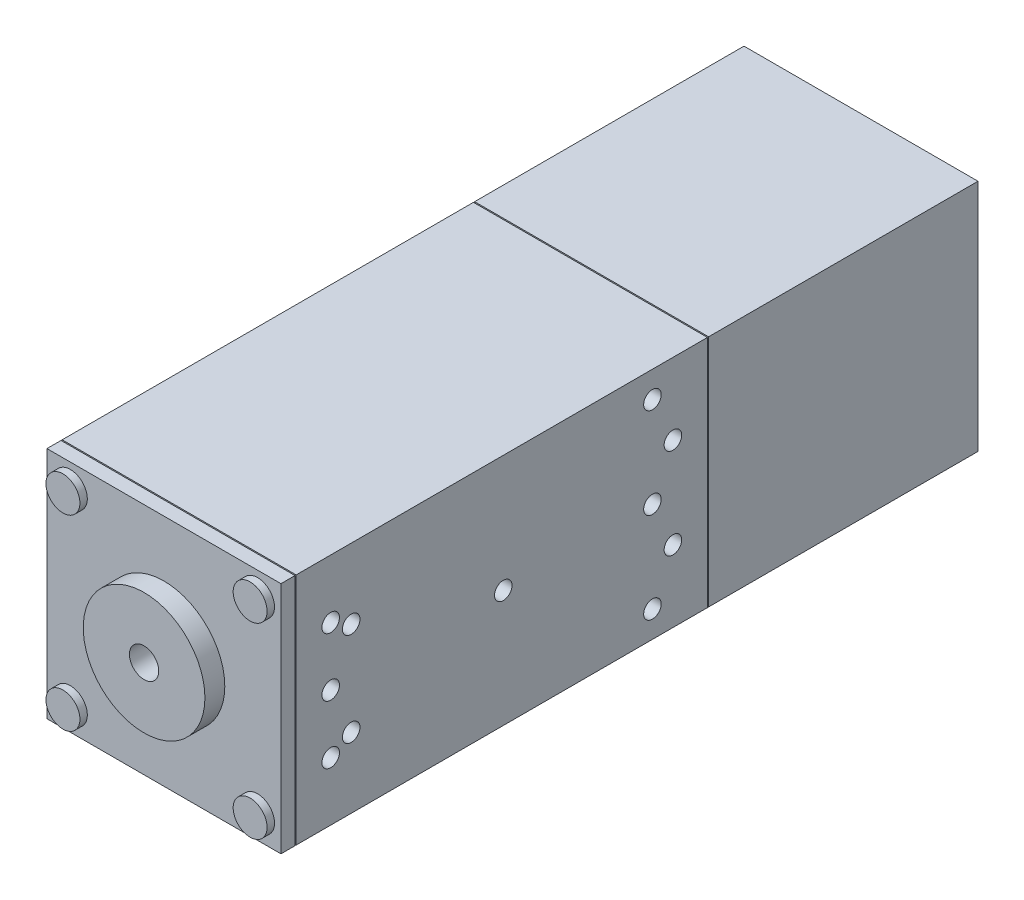
from build123d import *

# Parameters (mm, degrees)
CROQUIS1_W              = 40
CROQUIS1_H              = 40
SALIENTE_EXTRUIR1_DEPTH = 119.15
CROQUIS2_R              = 10.4
SALIENTE_EXTRUIR2_DEPTH = 3.4
SALIENTE_EXTRUIR3_DEPTH = 1.27
CROQUIS4_R              = 2.5
CORTAR_EXTRUIR1_DEPTH   = 5
CROQUIS5_W              = 9
CROQUIS5_H              = 6
CORTAR_EXTRUIR2_DEPTH   = 9
CROQUIS6_R              = 1.5
CORTAR_EXTRUIR3_DEPTH   = 3.5
SALIENTE_EXTRUIR4_DEPTH = 8
CROQUIS10_W             = 0.2
CROQUIS10_H             = 40
CORTAR_EXTRUIR4_DEPTH   = 0.2
MATRIZC1_COUNT          = 4


with BuildPart() as part:
    # Croquis1 → Saliente-Extruir1 (new body)
    with BuildSketch(Plane.XY):
        Rectangle(CROQUIS1_W, CROQUIS1_H)
    extrude(amount=-SALIENTE_EXTRUIR1_DEPTH)

    # Croquis2 → Saliente-Extruir2 (add)
    with BuildSketch(Plane.XY):
        Circle(CROQUIS2_R)
    extrude(amount=SALIENTE_EXTRUIR2_DEPTH)

    # Croquis3 → Saliente-Extruir3 (add)
    with BuildSketch(Plane.XY):
        with BuildLine():
            Line((-16, 13.1), (-16, 16))
            Line((-16, 16), (-13.1, 16))
            ThreePointArc((-13.1, 16), (-18.050609665, 18.050609665), (-16, 13.1))
        make_face()
        with BuildLine():
            Line((-13.1, 16), (-16, 16))
            Line((-16, 16), (-16, 13.1))
            ThreePointArc((-16, 13.1), (-13.949390335, 13.949390335), (-13.1, 16))
        make_face()
        with BuildLine():
            ThreePointArc((18.9, 16), (16, 18.9), (13.1, 16))
            Line((13.1, 16), (16, 16))
            Line((16, 16), (16, 13.1))
            ThreePointArc((16, 13.1), (18.050609665, 13.949390335), (18.9, 16))
        make_face()
        with BuildLine():
            Line((16, 16), (13.1, 16))
            ThreePointArc((13.1, 16), (13.949390335, 13.949390335), (16, 13.1))
            Line((16, 13.1), (16, 16))
        make_face()
        with BuildLine():
            ThreePointArc((-13.1, -16), (-13.949390335, -13.949390335), (-16, -13.1))
            Line((-16, -13.1), (-16, -16))
            Line((-16, -16), (-13.1, -16))
        make_face()
        with BuildLine():
            Line((-16, -16), (-16, -13.1))
            ThreePointArc((-16, -13.1), (-18.050609665, -18.050609665), (-13.1, -16))
            Line((-13.1, -16), (-16, -16))
        make_face()
        with BuildLine():
            ThreePointArc((18.9, -16), (18.050609665, -13.949390335), (16, -13.1))
            Line((16, -13.1), (16, -16))
            Line((16, -16), (13.1, -16))
            ThreePointArc((13.1, -16), (16, -18.9), (18.9, -16))
        make_face()
        with BuildLine():
            Line((16, -16), (16, -13.1))
            ThreePointArc((16, -13.1), (13.949390335, -13.949390335), (13.1, -16))
            Line((13.1, -16), (16, -16))
        make_face()
    extrude(amount=SALIENTE_EXTRUIR3_DEPTH)

    # Croquis4 → Cortar-Extruir1 (cut)
    with BuildSketch(Plane.XY.offset(3.4)):
        Circle(CROQUIS4_R)
    extrude(amount=-CORTAR_EXTRUIR1_DEPTH, mode=Mode.SUBTRACT)

    # Croquis5 → Cortar-Extruir2 (cut)
    with BuildSketch(Plane(origin=(0, 0, -119.15), x_dir=(-1, 0, 0), z_dir=(0, 0, -1))):
        with Locations((0, -17)):
            Rectangle(CROQUIS5_W, CROQUIS5_H)
    extrude(amount=-CORTAR_EXTRUIR2_DEPTH, mode=Mode.SUBTRACT)

    # Croquis6 → Cortar-Extruir3 (cut)
    with BuildSketch(Plane(origin=(20, 0, 0), x_dir=(0, 0, -1), z_dir=(1, 0, 0))):
        with Locations(Location((38, 0, 0), (0, 0, 90))):
            Circle(CROQUIS6_R)
        with Locations(Location((8.5, 0, 0), (0, 0, 90))):
            Circle(CROQUIS6_R)
        with Locations(Location((63.5, 0, 0), (0, 0, 90))):
            Circle(CROQUIS6_R)
        with Locations(Location((12, 8, 0), (0, 0, 90))):
            Circle(CROQUIS6_R)
        with Locations(Location((12, -8, 0), (0, 0, 90))):
            Circle(CROQUIS6_R)
        with Locations(Location((8.5, -10, 0), (0, 0, 90))):
            Circle(CROQUIS6_R)
        with Locations(Location((8.5, 10, 0), (0, 0, 90))):
            Circle(CROQUIS6_R)
        with Locations(Location((67, -7.75, 0), (0, 0, 90))):
            Circle(CROQUIS6_R)
        with Locations(Location((63.5, -15.5, 0), (0, 0, 90))):
            Circle(CROQUIS6_R)
        with Locations(Location((67, 7.75, 0), (0, 0, 90))):
            Circle(CROQUIS6_R)
        with Locations(Location((63.5, 15.5, 0), (0, 0, 90))):
            Circle(CROQUIS6_R)
    extrude(amount=-CORTAR_EXTRUIR3_DEPTH, mode=Mode.SUBTRACT)

    # Croquis9 → Saliente-Extruir4 (add)
    with BuildSketch(Plane(origin=(0, 0, -119.15), x_dir=(-1, 0, 0), z_dir=(0, 0, -1))):
        Polygon((-6.829794284, -20), (-6.829794284, -11.650544172), (6.829794284, -11.650544172), (6.829794284, -20), (4.5, -20), (4.5, -14), (-4.5, -14), (-4.5, -20), align=None)
    extrude(amount=SALIENTE_EXTRUIR4_DEPTH)

    # Croquis10 → Cortar-Extruir4 (cut)
    with BuildSketch(Plane(origin=(20, 0, 0), x_dir=(0, 0, -1), z_dir=(1, 0, 0))):
        with Locations((73, 0)):
            Rectangle(CROQUIS10_W, CROQUIS10_H)
        with Locations((2.5, 0)):
            Rectangle(CROQUIS10_W, CROQUIS10_H)
    cortar_extruir4 = extrude(amount=-CORTAR_EXTRUIR4_DEPTH, mode=Mode.SUBTRACT)

    # MatrizC1: Cortar-Extruir4 ×4 about axis
    matrizc1_axis = Axis((0, 0, 0), (0, 0, 1))
    for i in range(1, MATRIZC1_COUNT):
        add(cortar_extruir4.rotate(matrizc1_axis, i * 360 / MATRIZC1_COUNT), mode=Mode.SUBTRACT)


solid = part.part
